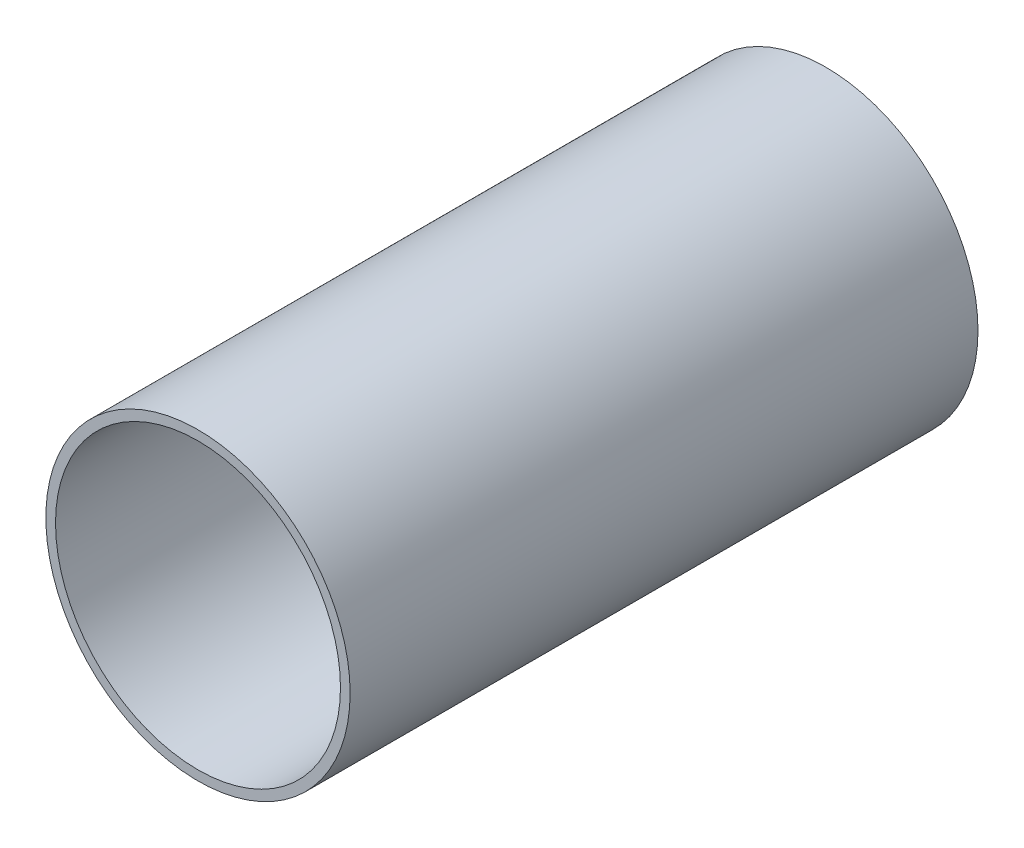
from build123d import *

# Parameters (mm, degrees)
ESQUISSE1_R        = 31.5
ESQUISSE1_R_2      = 29.5
BOSS_EXTRU_1_DEPTH = 130


with BuildPart() as part:
    # Esquisse1 → Boss.-Extru.1 (new body)
    with BuildSketch(Plane.XY):
        Circle(ESQUISSE1_R)
        Circle(ESQUISSE1_R_2, mode=Mode.SUBTRACT)
    extrude(amount=BOSS_EXTRU_1_DEPTH)


solid = part.part
